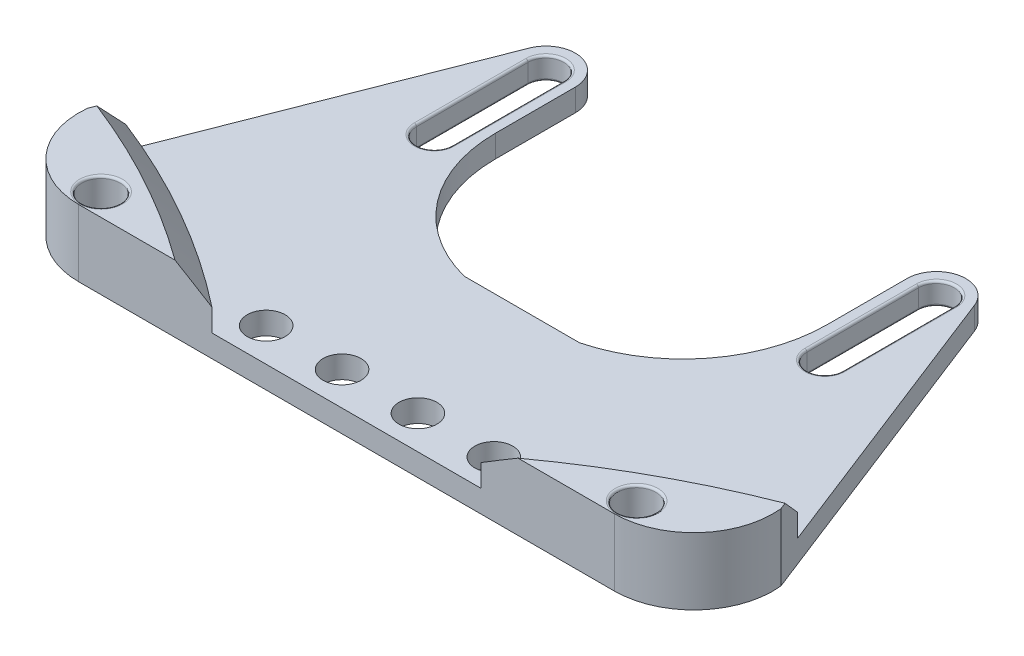
from build123d import *

# Parameters (mm, degrees)
ESBO_O1_R                = 1.725
RESSALTO_EXTRUS_O1_DEPTH = 2
ESBO_O2_R                = 1.725
RESSALTO_EXTRUS_O2_DEPTH = 4
CHANFRO1_SIZE            = 2
ESBO_O3_R                = 1.7
CORTE_EXTRUS_O1_DEPTH    = 4
FILETE3_R                = 0.2


with BuildPart() as part:
    # Esboço1 → Ressalto-extrusão1 (new body)
    with BuildSketch(Plane(origin=(0, 0, 0), x_dir=(1, 0, 0), z_dir=(0, 1, 0))):
        with BuildLine():
            Line((-24, -20.372893192), (24, -20.372893192))
            ThreePointArc((24, -20.372893192), (29.286739845, -18.020081616), (31.077511211, -12.517493279))
            Line((31.077511211, -12.517493279), (19.957237079, 15.959550104))
            ThreePointArc((19.957237079, 15.959550104), (17.01179115, 17.592373928), (14.862055637, 15))
            Line((14.862055637, 15), (14.862055637, 7.84553968))
            ThreePointArc((14.862055637, 7.84553968), (12.153811193, -0.067016155), (5.165078364, -4.660570472))
            Line((5.165078364, -4.660570472), (-5.165078364, -4.660570472))
            ThreePointArc((-5.165078364, -4.660570472), (-12.153811193, -0.067016155), (-14.862055637, 7.84553968))
            Line((-14.862055637, 7.84553968), (-14.862055637, 15))
            ThreePointArc((-14.862055637, 15), (-17.01179115, 17.592373928), (-19.957237079, 15.959550104))
            Line((-19.957237079, 15.959550104), (-31.077511211, -12.517493279))
            ThreePointArc((-31.077511211, -12.517493279), (-29.286739845, -18.020081616), (-24, -20.372893192))
        make_face()
        with Locations(Location((24, -18.372893192, 0), (0, 0, 90))):
            Circle(ESBO_O1_R, mode=Mode.SUBTRACT)
        with Locations(Location((-24, -18.372893192, 0), (0, 0, 270))):
            Circle(ESBO_O1_R, mode=Mode.SUBTRACT)
        with BuildLine():
            Line((-15.9, 15), (-15.9, 5))
            ThreePointArc((-15.9, 5), (-17.5, 3.4), (-19.1, 5))
            Line((-19.1, 5), (-19.1, 15))
            ThreePointArc((-19.1, 15), (-17.5, 16.6), (-15.9, 15))
        make_face(mode=Mode.SUBTRACT)
        with BuildLine():
            Line((15.9, 15), (15.9, 5))
            ThreePointArc((15.9, 5), (17.5, 3.4), (19.1, 5))
            Line((19.1, 5), (19.1, 15))
            ThreePointArc((19.1, 15), (17.5, 16.6), (15.9, 15))
        make_face(mode=Mode.SUBTRACT)
    extrude(amount=RESSALTO_EXTRUS_O1_DEPTH)

    # Esboço2 → Ressalto-extrusão2 (add)
    # profile 1 of 2: a face of its own
    with BuildSketch(Plane(origin=(0, 2, 0), x_dir=(1, 0, 0), z_dir=(0, 1, 0))):
        with BuildLine():
            Line((-12.060032838, -20.372893192), (-24, -20.372893192))
            ThreePointArc((-24, -20.372893192), (-29.286739845, -18.020081616), (-31.077511211, -12.517493279))
            Line((-31.077511211, -12.517493279), (-30.11182621, -10.044545817))
            ThreePointArc((-30.11182621, -10.044545817), (-20.70463745, -14.542300621), (-12.060032838, -20.372893192))
        make_face()
        with Locations(Location((-24, -18.372893192, 0), (0, 0, 270))):
            Circle(ESBO_O2_R, mode=Mode.SUBTRACT)
    # profile 2 of 2: a face of its own
    with BuildSketch(Plane(origin=(0, 2, 0), x_dir=(1, 0, 0), z_dir=(0, 1, 0))):
        with BuildLine():
            Line((30.11182621, -10.044545817), (31.077511211, -12.517493279))
            ThreePointArc((31.077511211, -12.517493279), (29.286739845, -18.020081616), (24, -20.372893192))
            Line((24, -20.372893192), (12.060032838, -20.372893192))
            ThreePointArc((12.060032838, -20.372893192), (20.70463745, -14.542300621), (30.11182621, -10.044545817))
        make_face()
        with Locations(Location((24, -18.372893192, 0), (0, 0, 90))):
            Circle(ESBO_O2_R, mode=Mode.SUBTRACT)
    extrude(amount=RESSALTO_EXTRUS_O2_DEPTH)

    # Chanfro1
    chanfro1_edges = [part.edges().sort_by_distance(p)[0] for p in [
        (-20.70463745, 6, 14.542300621),
        (20.70463745, 6, 14.542300621),
    ]]
    chamfer(chanfro1_edges, length=CHANFRO1_SIZE)

    # Esboço3 → Corte-extrusão1 (cut)
    with BuildSketch(Plane(origin=(0, 2, 0), x_dir=(1, 0, 0), z_dir=(0, 1, 0))):
        with Locations(Location((-3.4, -17.372893192, 0), (0, 0, 270))):
            Circle(ESBO_O3_R)
        with Locations(Location((-10.2, -17.372893192, 0), (0, 0, 270))):
            Circle(ESBO_O3_R)
        with Locations(Location((10.2, -17.372893192, 0), (0, 0, 90))):
            Circle(ESBO_O3_R)
        with Locations(Location((3.4, -17.372893192, 0), (0, 0, 90))):
            Circle(ESBO_O3_R)
    extrude(amount=-CORTE_EXTRUS_O1_DEPTH, mode=Mode.SUBTRACT)

    # Filete3
    filete3_edges = [part.edges().sort_by_distance(p)[0] for p in [
        (24, 0, 20.097893192),
        (-17.5, 0, -16.6),
        (-19.1, 0, -10),
        (-17.5, 0, -3.4),
        (-15.9, 0, -10),
        (-17.5, 2, -16.6),
        (-19.1, 2, -10),
        (-17.5, 2, -3.4),
        (-15.9, 2, -10),
        (-24, 0, 16.647893192),
        (17.5, 0, -16.6),
        (15.9, 0, -10),
        (17.5, 0, -3.4),
        (19.1, 0, -10),
        (17.5, 2, -16.6),
        (15.9, 2, -10),
        (17.5, 2, -3.4),
        (19.1, 2, -10),
        (-24, 6, 16.647893192),
        (24, 6, 20.097893192),
    ]]
    fillet(filete3_edges, radius=FILETE3_R)


solid = part.part
